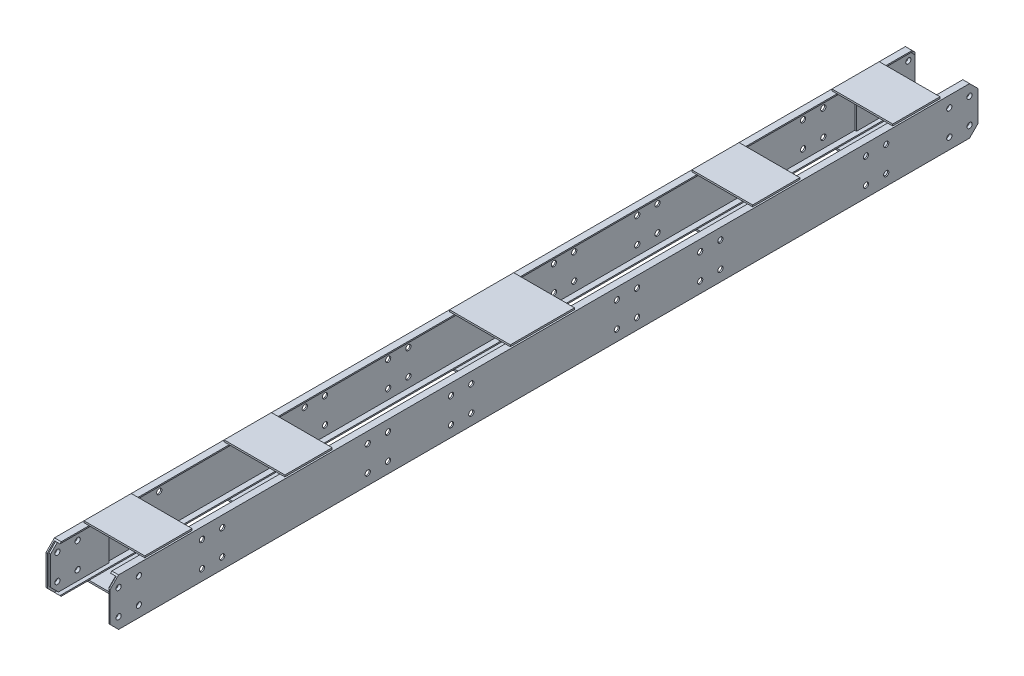
from build123d import *

# Parameters (mm, degrees)
EXTRUDE_1_DEPTH     = 2570
SKETCH_2_W          = 360
SKETCH_2_H          = 280
SKETCH_2_H_2        = 190
EXTRUDE_2_DEPTH     = 10
SKETCH_5_R          = 15.5
CUT_EXTRUDE_3_DEPTH = 2603.268241362
EXTRUDE_8_DEPTH     = 10
SKETCH_5_6_R        = 15.5
CUT_EXTRUDE_9_DEPTH = 2603.268241362


with BuildPart() as part:
    # 草图1 → 拉伸1 (new body)
    with BuildSketch(Plane.XY):
        Polygon((-150, 140), (-190, 140), (-190, -140), (-150, -140), (-150, -132.5), (-182.5, -132.5), (-182.5, 132.5), (-150, 132.5), align=None)
    extrude(amount=EXTRUDE_1_DEPTH)

    # 草图2 → 拉伸2 (add)
    with BuildSketch(Plane(origin=(0, 140, 0), x_dir=(1, 0, 0), z_dir=(0, 1, 0))):
        with Locations((0, -355)):
            Rectangle(SKETCH_2_W, SKETCH_2_H)
        with Locations((0, -1185)):
            Rectangle(SKETCH_2_W, SKETCH_2_H)
        with Locations((0, -2475)):
            Rectangle(SKETCH_2_W, SKETCH_2_H_2)
    extrude(amount=EXTRUDE_2_DEPTH)

    # 镜向2: part across plane


with BuildPart() as part_1:
    add(part.part)
    add(part.part.mirror(Plane(origin=(0, 0, 0), x_dir=(0, 0, 1), z_dir=(1, 0, 0))))

    # 镜向3: part across plane


with BuildPart() as part_2:
    add(part_1.part)
    add(part_1.part.mirror(Plane.ZX))

    # 草图5 → 拉伸3 (cut, through all)
    with BuildSketch(Plane.ZY.offset(190)):
        with Locations((50, 75)):
            Circle(SKETCH_5_R)
        with Locations((170, 75)):
            Circle(SKETCH_5_R)
        with Locations((50, -75)):
            Circle(SKETCH_5_R)
        with Locations((170, -75)):
            Circle(SKETCH_5_R)
        with Locations((543.5, 75)):
            Circle(SKETCH_5_R)
        with Locations((663.5, 75)):
            Circle(SKETCH_5_R)
        with Locations((663.5, -75)):
            Circle(SKETCH_5_R)
        with Locations((543.5, -75)):
            Circle(SKETCH_5_R)
        with Locations((1645.5, 75)):
            Circle(SKETCH_5_R)
        with Locations((1525.5, 75)):
            Circle(SKETCH_5_R)
        with Locations((1525.5, -75)):
            Circle(SKETCH_5_R)
        with Locations((1645.5, -75)):
            Circle(SKETCH_5_R)
        with Locations((2139, 75)):
            Circle(SKETCH_5_R)
        with Locations((2019, 75)):
            Circle(SKETCH_5_R)
        with Locations((2019, -75)):
            Circle(SKETCH_5_R)
        with Locations((2139, -75)):
            Circle(SKETCH_5_R)
        Polygon((50, 140), (0, 90), (0, 140), align=None)
        Polygon((0, -90), (50, -140), (0, -140), align=None)
    extrude(amount=-CUT_EXTRUDE_3_DEPTH, mode=Mode.SUBTRACT)

    # 草图10 → 拉伸8 (add)
    with BuildSketch(Plane.ZY.offset(-182.5)):
        Polygon((10, 85.857864376), (10, -85.857864376), (56.642135624, -132.5), (356.642135624, -132.5), (356.642135624, 132.5), (56.642135624, 132.5), align=None)
    extrude_8 = extrude(amount=EXTRUDE_8_DEPTH)

    # 镜向6: 拉伸8 across plane
    add(extrude_8.mirror(Plane(origin=(0, 0, 0), x_dir=(0, 0, 1), z_dir=(1, 0, 0))))

    # 草图5<6> → 拉伸9 (cut, through all)
    with BuildSketch(Plane.ZY.offset(190)):
        with Locations((50, 75)):
            Circle(SKETCH_5_6_R)
        with Locations((170, 75)):
            Circle(SKETCH_5_6_R)
        with Locations((50, -75)):
            Circle(SKETCH_5_6_R)
        with Locations((170, -75)):
            Circle(SKETCH_5_6_R)
        with Locations((543.5, 75)):
            Circle(SKETCH_5_6_R)
        with Locations((663.5, 75)):
            Circle(SKETCH_5_6_R)
        with Locations((663.5, -75)):
            Circle(SKETCH_5_6_R)
        with Locations((543.5, -75)):
            Circle(SKETCH_5_6_R)
        with Locations((1645.5, 75)):
            Circle(SKETCH_5_6_R)
        with Locations((1525.5, 75)):
            Circle(SKETCH_5_6_R)
        with Locations((1525.5, -75)):
            Circle(SKETCH_5_6_R)
        with Locations((1645.5, -75)):
            Circle(SKETCH_5_6_R)
        with Locations((2139, 75)):
            Circle(SKETCH_5_6_R)
        with Locations((2019, 75)):
            Circle(SKETCH_5_6_R)
        with Locations((2019, -75)):
            Circle(SKETCH_5_6_R)
        with Locations((2139, -75)):
            Circle(SKETCH_5_6_R)
        Polygon((50, 140), (0, 90), (0, 140), align=None)
        Polygon((0, -90), (50, -140), (0, -140), align=None)
    extrude(amount=-CUT_EXTRUDE_9_DEPTH, mode=Mode.SUBTRACT)

    # 镜向7: part across plane


with BuildPart() as part_3:
    add(part_2.part)
    add(part_2.part.mirror(Plane.XY.offset(2570)))


solid = part_3.part
